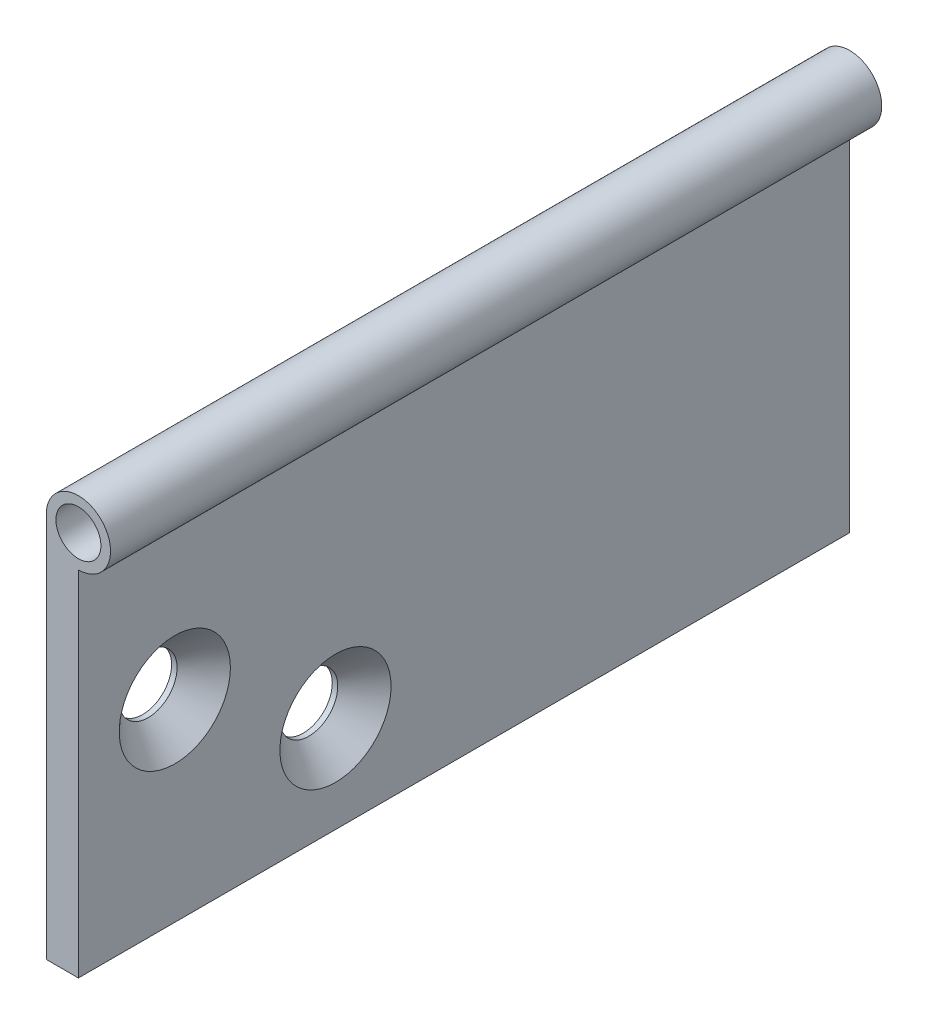
from build123d import *

# Parameters (mm, degrees)
SKETCH_1_W                 = 5
SKETCH_1_H                 = 60
EXTRUDE_1_DEPTH            = 60
SKETCH_2_R                 = 5
SKETCH_3_R                 = 3.5
CUT_EXTRUDE_1_DEPTH        = 137.839321834
HOLE_WIZARD_M84_AT_2_COUNT = 2
HOLE_WIZARD_M84_AT_2_PITCH = 29.154759474


with BuildPart() as part:
    # Эскиз1 → Вытянуть-Тонкостенный1 (new, symmetric)
    with BuildSketch(Plane.XY):
        with Locations((2.5, 30)):
            Rectangle(SKETCH_1_W, SKETCH_1_H)
    extrude(amount=EXTRUDE_1_DEPTH, both=True)

    # По траектории1: sweep along a curve in space
    with BuildLine() as sweep_1_path:
        Line((5, 60, 60), (5, 60, -60))
    # Эскиз2 → По траектории1 (sweep)
    with BuildSketch(Plane.XY.offset(60)):
        with Locations((5, 60)):
            Circle(SKETCH_2_R)
    sweep(path=sweep_1_path.line)

    # Эскиз3 → Вырез-Вытянуть1 (cut, through all)
    with BuildSketch(Plane.XY.offset(60)):
        with Locations((5, 60)):
            Circle(SKETCH_3_R)
    extrude(amount=-CUT_EXTRUDE_1_DEPTH, mode=Mode.SUBTRACT)

    # Эскиз11 → Зенковка для  винта с плоской головкой M84 (revolve, cut)
    with BuildSketch(Plane(origin=(5, 30, 45), x_dir=(0, 0, -1), z_dir=(0, 1, 0))):
        Polygon((0, 0), (0, 5), (4.5, 5), (4.5, 4.15), (8.65, 0), align=None)
    hole_wizard_m84 = revolve(axis=Axis((11.35, 30, 45), (-1, 0, 0)), mode=Mode.SUBTRACT)

    # Зенковка для  винта с плоской головкой M84 at 2: Зенковка для  винта с плоской головкой M84 ×2
    with Locations(*[Vector(0, -0.5144957554275265, -0.8574929257125442) * (i * HOLE_WIZARD_M84_AT_2_PITCH) for i in range(1, HOLE_WIZARD_M84_AT_2_COUNT)]):
        add(hole_wizard_m84, mode=Mode.SUBTRACT)


solid = part.part
